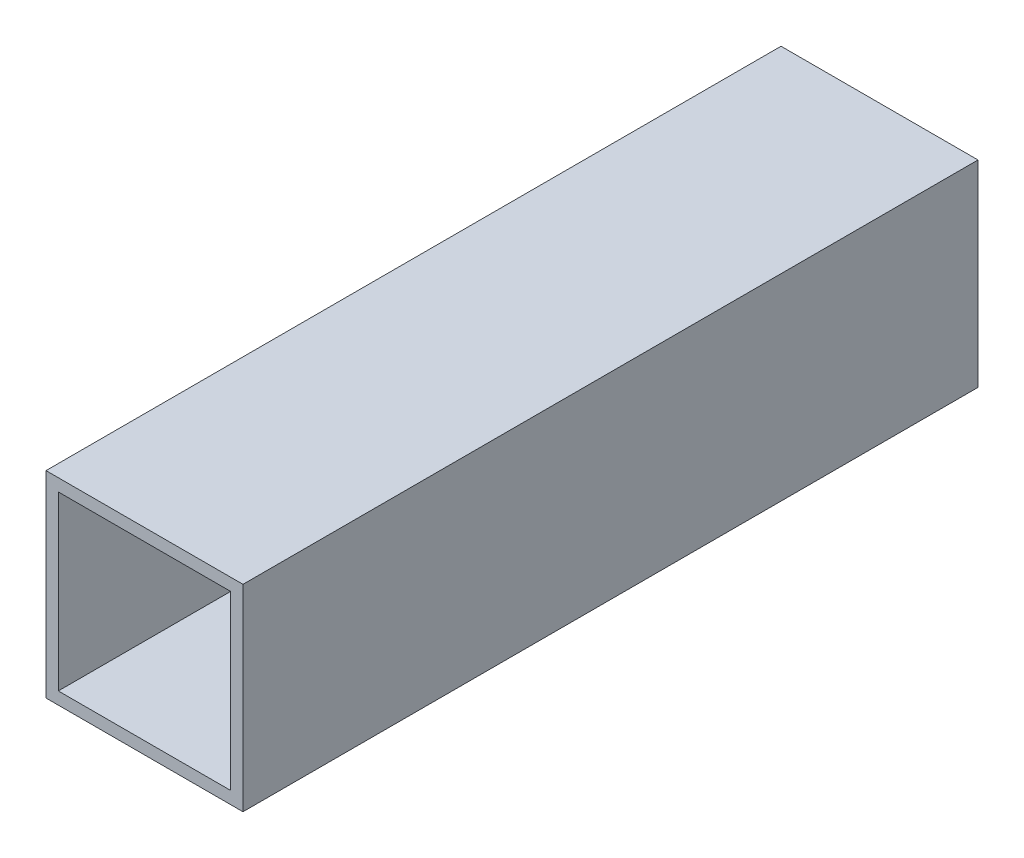
from build123d import *

# Parameters (mm, degrees)
SKETCH1_W           = 25.4
SKETCH1_H           = 25.4
SKETCH1_W_2         = 22.225
SKETCH1_H_2         = 22.225
BOSS_EXTRUDE1_DEPTH = 94.78


with BuildPart() as part:
    # Sketch1 → Boss-Extrude1 (new body)
    with BuildSketch(Plane.XY):
        Rectangle(SKETCH1_W, SKETCH1_H)
        Rectangle(SKETCH1_W_2, SKETCH1_H_2, mode=Mode.SUBTRACT)
    extrude(amount=BOSS_EXTRUDE1_DEPTH)


solid = part.part
